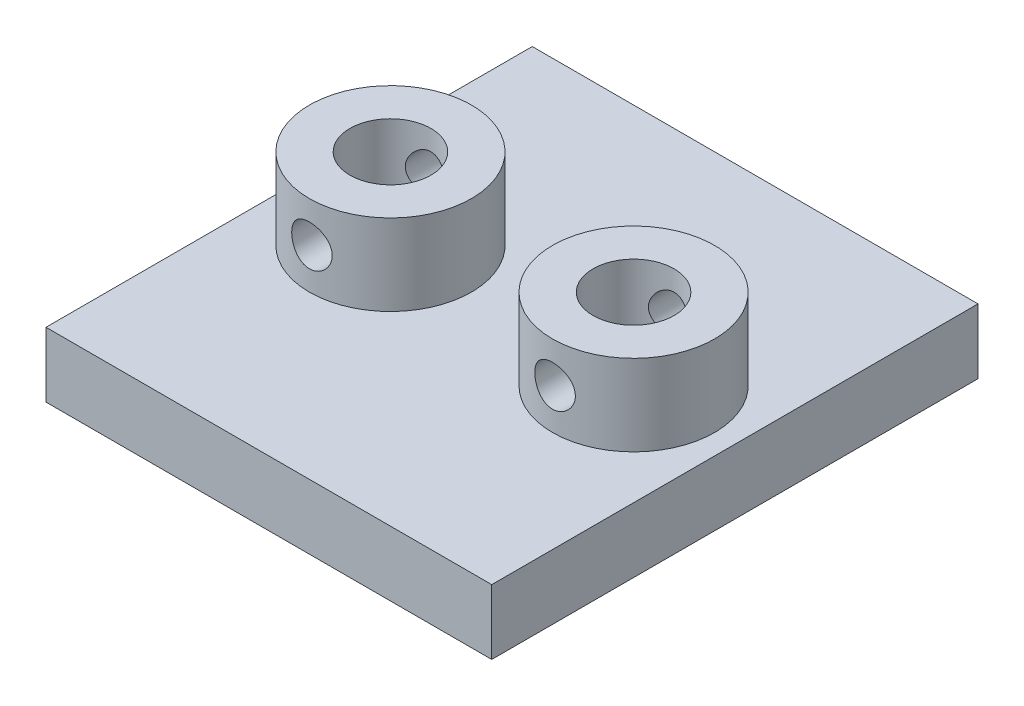
from build123d import *

# Parameters (mm, degrees)
SKETCH1_W               = 11
SKETCH1_H               = 12
BOSS_EXTRUDE1_DEPTH     = 1.6
SKETCH2_R               = 2
SKETCH2_R_2             = 1
BOSS_EXTRUDE2_DEPTH     = 2
CUT_EXTRUDE1_DEPTH      = 2
CUT_EXTRUDE1_DEPTH_BACK = 2
SKETCH3_R               = 0.5


with BuildPart() as part:
    # Sketch1 → Boss-Extrude1 (new body)
    with BuildSketch(Plane(origin=(0, 0, 0), x_dir=(1, 0, 0), z_dir=(0, 1, 0))):
        Rectangle(SKETCH1_W, SKETCH1_H)
    extrude(amount=BOSS_EXTRUDE1_DEPTH)

    # Sketch2 → Boss-Extrude2 (add)
    # profile 1 of 2: a face of its own
    with BuildSketch(Plane(origin=(0, 1.6, 0), x_dir=(1, 0, 0), z_dir=(0, 1, 0))):
        with Locations(Location((-3, 0, 0), (0, 0, 270))):
            Circle(SKETCH2_R)
        with Locations(Location((-3, 0, 0), (0, 0, 270))):
            Circle(SKETCH2_R_2, mode=Mode.SUBTRACT)
    # profile 2 of 2: a face of its own
    with BuildSketch(Plane(origin=(0, 1.6, 0), x_dir=(1, 0, 0), z_dir=(0, 1, 0))):
        with Locations(Location((3, 0, 0), (0, 0, 270))):
            Circle(SKETCH2_R)
        with Locations(Location((3, 0, 0), (0, 0, 270))):
            Circle(SKETCH2_R_2, mode=Mode.SUBTRACT)
    extrude(amount=BOSS_EXTRUDE2_DEPTH)

    # Sketch3 → Cut-Extrude1 (cut, two sides: drawn at the far end of the back side and taken through both)
    with BuildSketch(Plane.XY.offset(-CUT_EXTRUDE1_DEPTH_BACK)):
        with Locations(Location((-3, 2.6, 0), (0, 0, 270.000000002))):
            Circle(SKETCH3_R)
        with Locations(Location((3, 2.6, 0), (0, 0, 270.000000002))):
            Circle(SKETCH3_R)
    extrude(amount=CUT_EXTRUDE1_DEPTH + CUT_EXTRUDE1_DEPTH_BACK, mode=Mode.SUBTRACT)


solid = part.part
